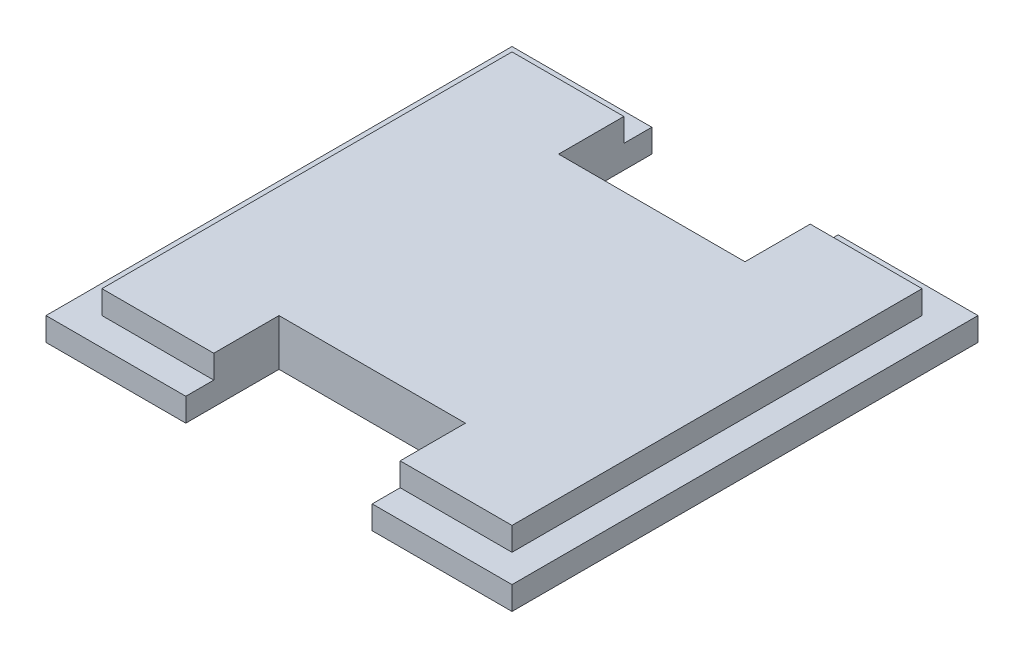
from build123d import *

# Parameters (mm, degrees)
SKETCH1_W           = 100
SKETCH1_H           = 100
BOSS_EXTRUDE1_DEPTH = 5
SKETCH2_W           = 88
SKETCH2_H           = 88
BOSS_EXTRUDE2_DEPTH = 5
SKETCH3_W           = 40
SKETCH3_H           = 20
CUT_EXTRUDE1_DEPTH  = 10


with BuildPart() as part:
    # Sketch1 → Boss-Extrude1 (new body)
    with BuildSketch(Plane(origin=(0, 0, 0), x_dir=(1, 0, 0), z_dir=(0, 1, 0))):
        with Locations((50, 50)):
            Rectangle(SKETCH1_W, SKETCH1_H)
    extrude(amount=BOSS_EXTRUDE1_DEPTH)

    # Sketch2 → Boss-Extrude2 (add)
    with BuildSketch(Plane(origin=(0, 5, 0), x_dir=(1, 0, 0), z_dir=(0, 1, 0))):
        with Locations((50, 50)):
            Rectangle(SKETCH2_W, SKETCH2_H)
    extrude(amount=BOSS_EXTRUDE2_DEPTH)

    # Sketch3 → Cut-Extrude1 (cut)
    with BuildSketch(Plane.XZ):
        with Locations((50, -90)):
            Rectangle(SKETCH3_W, SKETCH3_H)
        with Locations((50, -10)):
            Rectangle(SKETCH3_W, SKETCH3_H)
    extrude(amount=-CUT_EXTRUDE1_DEPTH, mode=Mode.SUBTRACT)


solid = part.part
